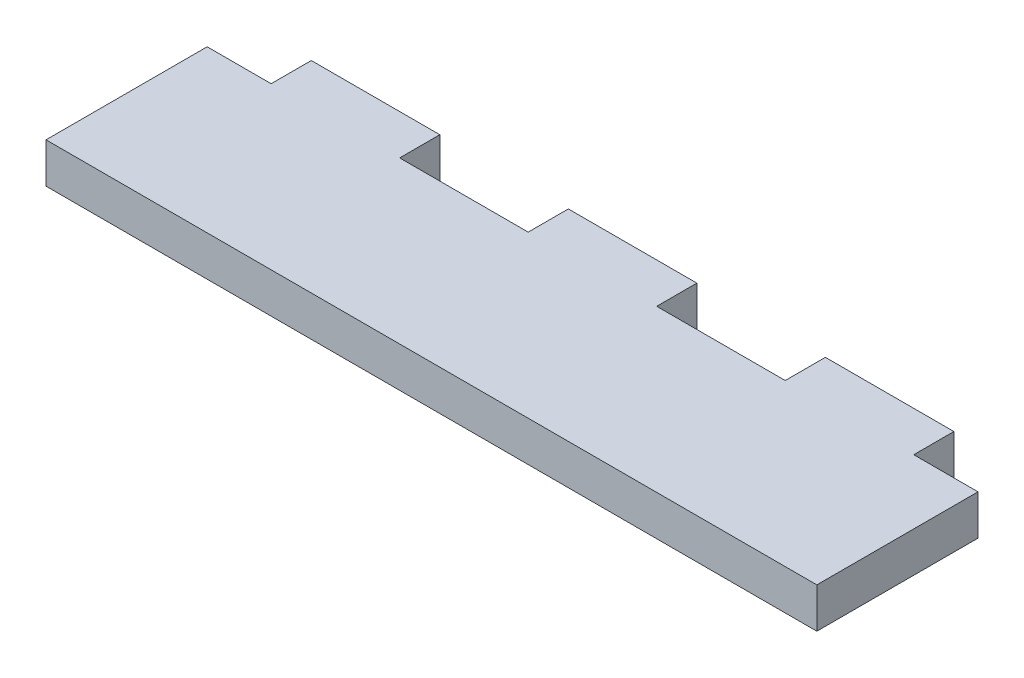
from build123d import *

# Parameters (mm, degrees)
SKETCH1_W                     = 10.16
SKETCH1_H                     = 3.175
SKETCH1_W_2                   = 152.4
SKETCH1_H_2                   = 82.55
SKETCH1_R                     = 7.747
MAIN_EXTRUDE_DEPTH            = 3.175
SKETCH2_R                     = 2.54
CASTER_MOUNTING_HOLES_DEPTH   = 89.274136218
SKETCH3_W                     = 2.54
SKETCH3_H                     = 82.55
REMOVE_UNEVEN_BACK_EDGE_DEPTH = 89.274136218
CUT_EXTRUDE2_DEPTH            = 89.274136218


with BuildPart() as part:
    # Sketch1 → Main Extrude (new body)
    # profile 1 of 7: a face of its own
    with BuildSketch(Plane(origin=(0, 0, 0), x_dir=(1, 0, 0), z_dir=(0, 1, 0))):
        with Locations((43.18, -42.8625)):
            Rectangle(SKETCH1_W, SKETCH1_H)
    # profile 2 of 7: a face of its own
    with BuildSketch(Plane(origin=(0, 0, 0), x_dir=(1, 0, 0), z_dir=(0, 1, 0))):
        Rectangle(SKETCH1_W_2, SKETCH1_H_2)
        with Locations(Location((-65.076590574, 0, 0), (0, 0, 270))):
            Circle(SKETCH1_R, mode=Mode.SUBTRACT)
    # profile 3 of 7: a face of its own
    with BuildSketch(Plane(origin=(0, 0, 0), x_dir=(1, 0, 0), z_dir=(0, 1, 0))):
        with Locations((63.5, -42.8625)):
            Rectangle(SKETCH1_W, SKETCH1_H)
    # profile 4 of 7: a face of its own
    with BuildSketch(Plane(origin=(0, 0, 0), x_dir=(1, 0, 0), z_dir=(0, 1, 0))):
        with Locations((22.86, -42.8625)):
            Rectangle(SKETCH1_W, SKETCH1_H)
    # profile 5 of 7: a face of its own
    with BuildSketch(Plane(origin=(0, 0, 0), x_dir=(1, 0, 0), z_dir=(0, 1, 0))):
        with Locations((63.5, 42.8625)):
            Rectangle(SKETCH1_W, SKETCH1_H)
    # profile 6 of 7: a face of its own
    with BuildSketch(Plane(origin=(0, 0, 0), x_dir=(1, 0, 0), z_dir=(0, 1, 0))):
        with Locations((43.18, 42.8625)):
            Rectangle(SKETCH1_W, SKETCH1_H)
    # profile 7 of 7: a face of its own
    with BuildSketch(Plane(origin=(0, 0, 0), x_dir=(1, 0, 0), z_dir=(0, 1, 0))):
        with Locations((22.86, 42.8625)):
            Rectangle(SKETCH1_W, SKETCH1_H)
    extrude(amount=MAIN_EXTRUDE_DEPTH)

    # Sketch2 → Caster Mounting Holes (cut, through all)
    with BuildSketch(Plane(origin=(0, 3.175, 0), x_dir=(1, 0, 0), z_dir=(0, 1, 0))):
        with Locations(Location((-47.3754273, 15.24, 0), (0, 0, 270))):
            Circle(SKETCH2_R)
        with Locations(Location((-23.4994273, 15.24, 0), (0, 0, 270))):
            Circle(SKETCH2_R)
        with Locations(Location((-23.4994273, -15.24, 0), (0, 0, 270))):
            Circle(SKETCH2_R)
        with Locations(Location((-47.3754273, -15.24, 0), (0, 0, 270))):
            Circle(SKETCH2_R)
    extrude(amount=-CASTER_MOUNTING_HOLES_DEPTH, mode=Mode.SUBTRACT)

    # Sketch3 → Remove Uneven Back Edge (cut, through all)
    with BuildSketch(Plane(origin=(0, 3.175, 0), x_dir=(1, 0, 0), z_dir=(0, 1, 0))):
        with Locations((74.93, 0)):
            Rectangle(SKETCH3_W, SKETCH3_H)
    extrude(amount=-REMOVE_UNEVEN_BACK_EDGE_DEPTH, mode=Mode.SUBTRACT)

    # Sketch4 → Cut-Extrude2 (cut, through all)
    with BuildSketch(Plane(origin=(0, 3.175, 0), x_dir=(1, 0, 0), z_dir=(0, 1, 0))):
        Polygon((12.722439957, 54.007099157), (12.722439957, 28.534320342), (84.718317581, 28.534320342), (84.718317581, -50.041057477), (-114.731091279, -51.937564591), (-115.738488642, 54.007099157), align=None)
    extrude(amount=-CUT_EXTRUDE2_DEPTH, mode=Mode.SUBTRACT)


solid = part.part
